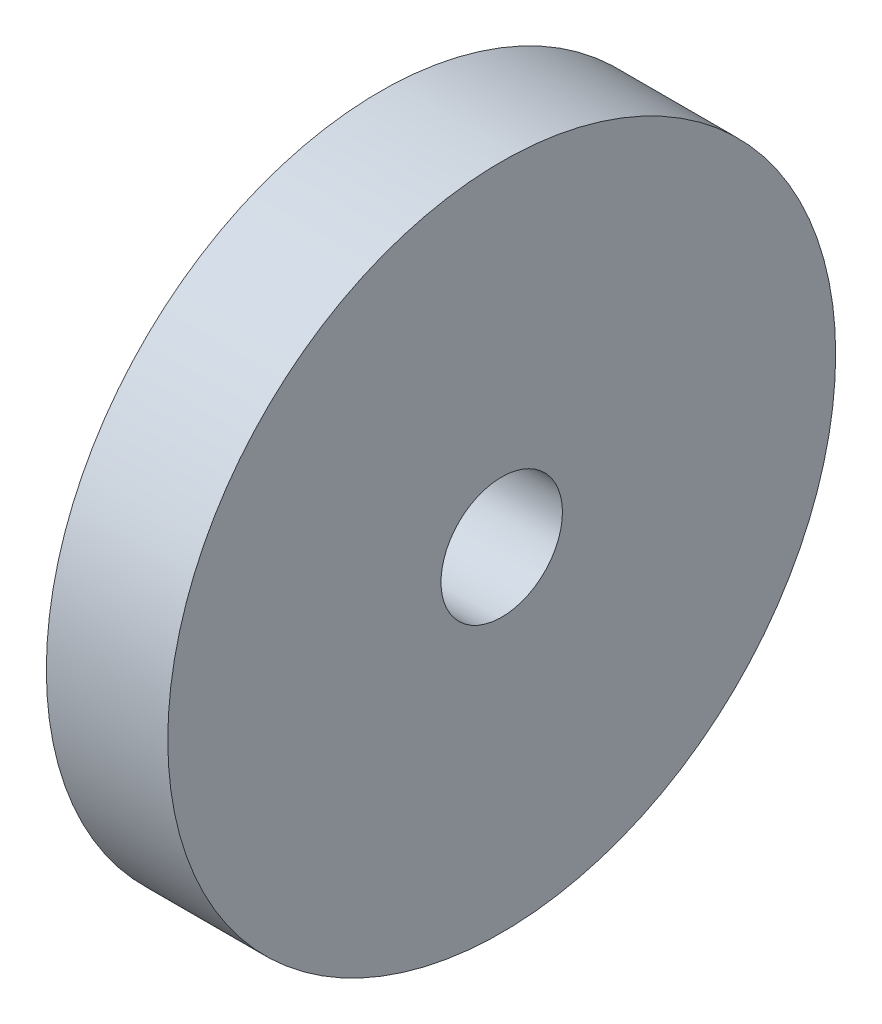
from build123d import *

# Parameters (mm, degrees)
SKETCH1_R           = 5.5
SKETCH1_R_2         = 1
BOSS_EXTRUDE1_DEPTH = 2


with BuildPart() as part:
    # Sketch1 → Boss-Extrude1 (new body)
    with BuildSketch(Plane(origin=(0, 0, 0), x_dir=(0, 0, -1), z_dir=(1, 0, 0))):
        Circle(SKETCH1_R)
        Circle(SKETCH1_R_2, mode=Mode.SUBTRACT)
    extrude(amount=BOSS_EXTRUDE1_DEPTH)


solid = part.part
